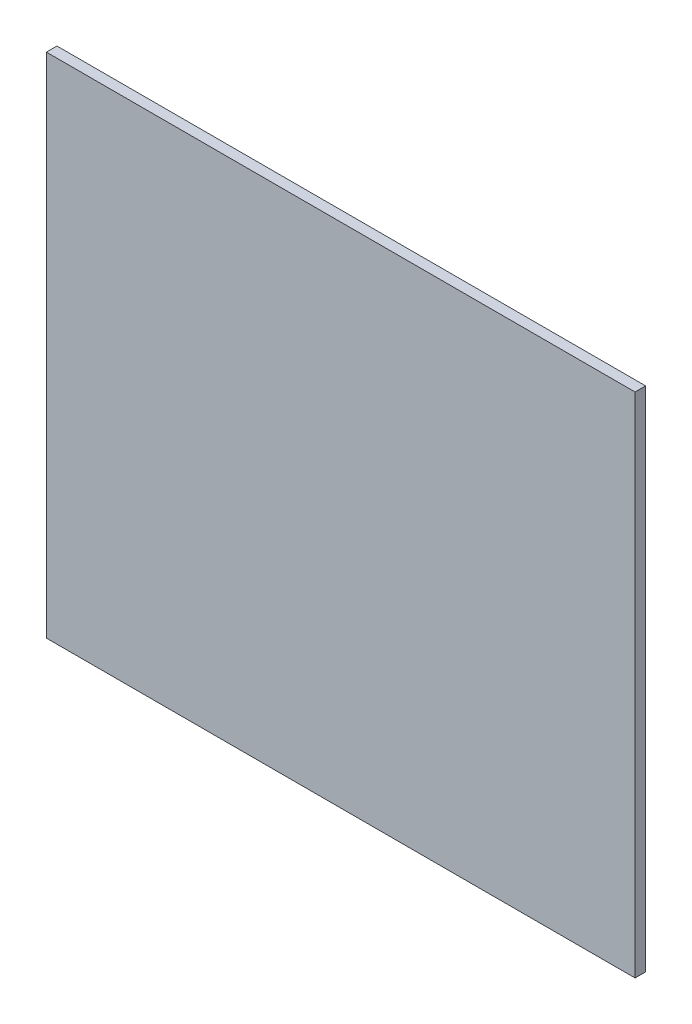
from build123d import *

# Parameters (mm, degrees)
SKETCH1_W           = 176.784
SKETCH1_H           = 152.4
BOSS_EXTRUDE1_DEPTH = 3.175


with BuildPart() as part:
    # Sketch1 → Boss-Extrude1 (new body)
    with BuildSketch(Plane.XY):
        with Locations((88.392, 76.2)):
            Rectangle(SKETCH1_W, SKETCH1_H)
    extrude(amount=BOSS_EXTRUDE1_DEPTH)


solid = part.part
